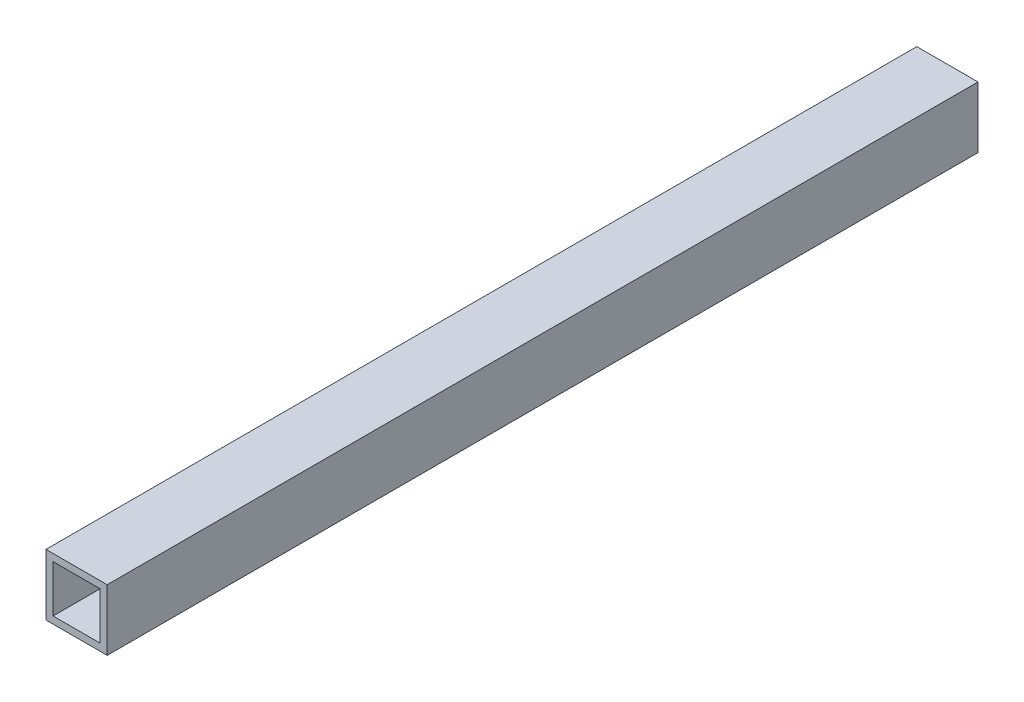
from build123d import *

# Parameters (mm, degrees)
SKETCH1_W           = 13
SKETCH1_H           = 13
SKETCH1_W_2         = 10
SKETCH1_H_2         = 10
BOSS_EXTRUDE1_DEPTH = 185


with BuildPart() as part:
    # Sketch1 → Boss-Extrude1 (new body)
    with BuildSketch(Plane.XY):
        Rectangle(SKETCH1_W, SKETCH1_H)
        Rectangle(SKETCH1_W_2, SKETCH1_H_2, mode=Mode.SUBTRACT)
    extrude(amount=BOSS_EXTRUDE1_DEPTH)


solid = part.part
